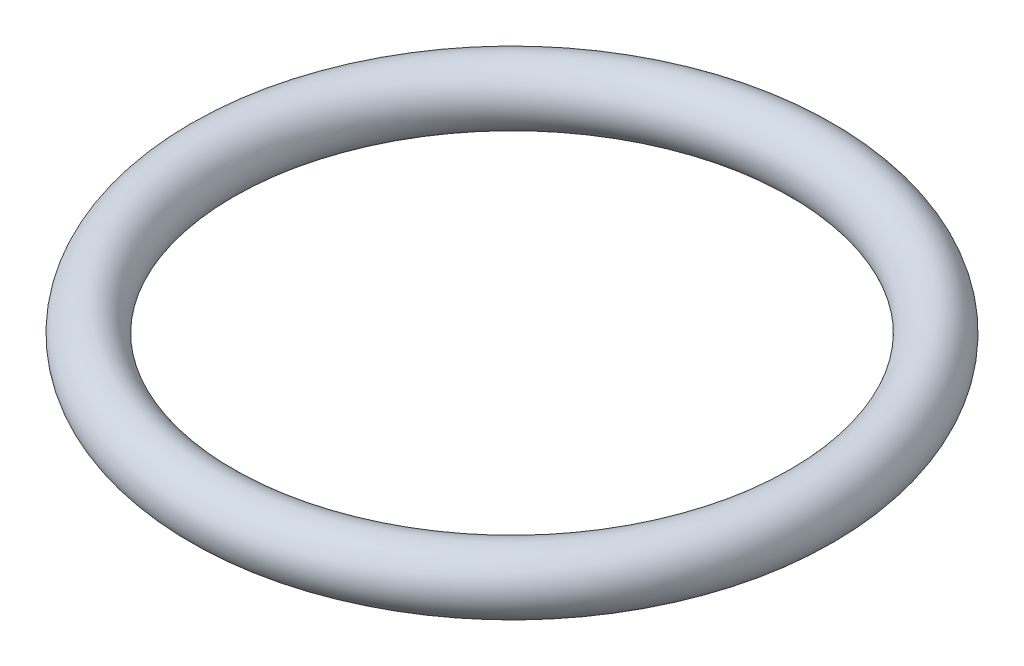
from build123d import *

# Parameters (mm, degrees)
SKETCH_2_R = 2.5


with BuildPart() as part:
    # 扫描1: sweep along a path in 草图1
    with BuildLine(Plane(origin=(0, 0, 0), x_dir=(1, 0, 0), z_dir=(0, 1, 0))) as sweep_1_path:
        CenterArc((0, 0), 25, 0, 360)
    # 草图2 → 扫描1 (sweep)
    with BuildSketch(Plane.XY):
        with Locations((-25, 0)):
            Circle(SKETCH_2_R)
    sweep(path=sweep_1_path.line)


solid = part.part
